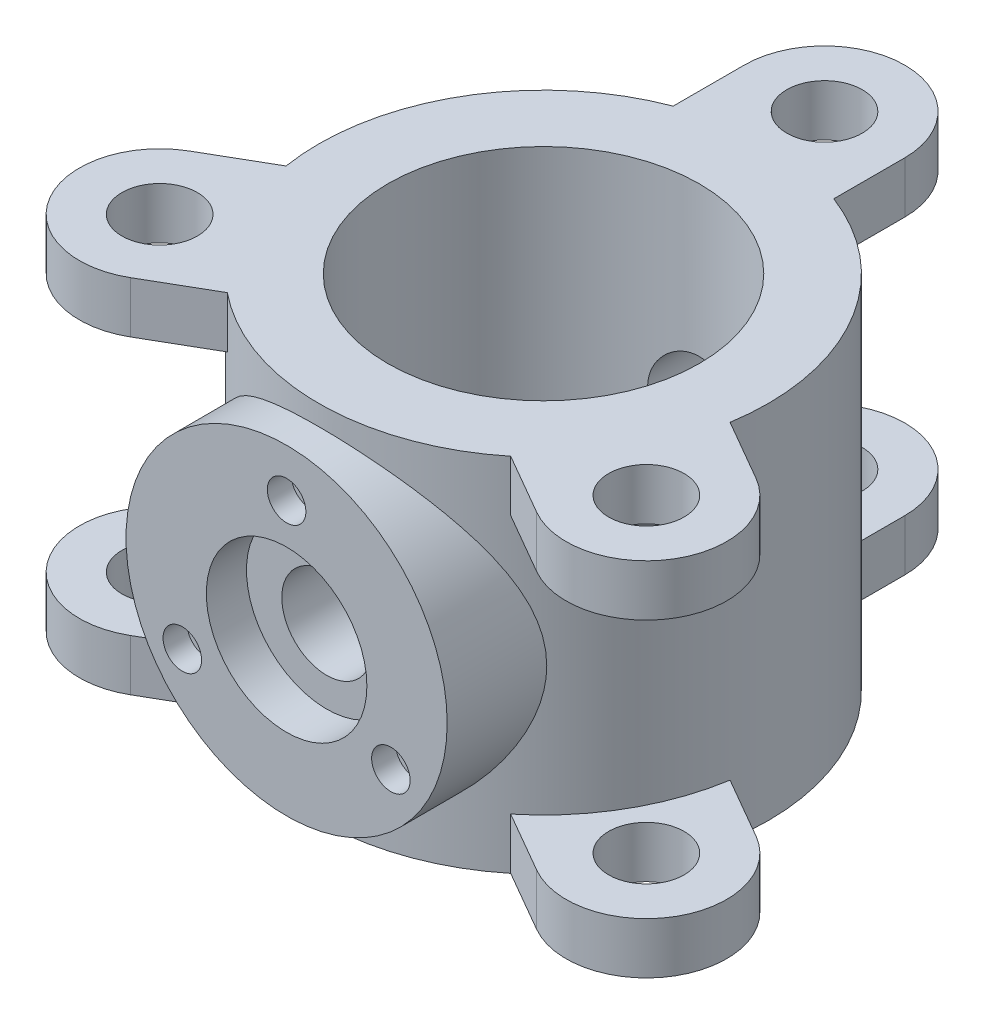
from build123d import *

# Parameters (mm, degrees)
SKETCH1_R                = 140
SKETCH1_R_2              = 97
BOSS_EXTRUDE1_DEPTH      = 225
SKETCH2_R                = 23.5
BOSS_EXTRUDE2_DEPTH      = 32
CIRPATTERN1_COUNT        = 3
MIRROR1_COPY_1_SKETCH_R  = 23.5
MIRROR1_COPY_1_DEPTH     = 32
MIRROR1_COPY_2_SKETCH_R  = 23.5
MIRROR1_COPY_2_DEPTH     = 32
BOSS_EXTRUDE3_REACH      = 491.361
BOSS_EXTRUDE3_END_RADIUS = 140
SKETCH3_R                = 100
SKETCH4_R                = 50
CUT_EXTRUDE1_DEPTH       = 25
SKETCH5_R                = 28
CUT_EXTRUDE2_DEPTH       = 470.945948606
SKETCH6_R                = 12
CUT_EXTRUDE3_DEPTH       = 15
CIRPATTERN2_COUNT        = 3


with BuildPart() as part:
    # Sketch1 → Boss-Extrude1 (new body)
    with BuildSketch(Plane(origin=(0, 0, 0), x_dir=(1, 0, 0), z_dir=(0, 1, 0))):
        with Locations(Location((0, 0, 0), (0, 0, 270))):
            Circle(SKETCH1_R)
        with Locations(Location((0, 0, 0), (0, 0, 270))):
            Circle(SKETCH1_R_2, mode=Mode.SUBTRACT)
    extrude(amount=BOSS_EXTRUDE1_DEPTH)

    # Sketch2 → Boss-Extrude2 (add)
    with BuildSketch(Plane(origin=(0, 225, 0), x_dir=(1, 0, 0), z_dir=(0, 1, 0))):
        with BuildLine():
            Line((-50, 175), (-50, 114.896497963))
            Line((-50, 114.896497963), (50, 114.896497963))
            Line((50, 114.896497963), (50, 175))
            ThreePointArc((50, 175), (0, 225), (-50, 175))
        make_face()
        with Locations(Location((0, 175, 0), (0, 0, 270))):
            Circle(SKETCH2_R, mode=Mode.SUBTRACT)
    boss_extrude2 = extrude(amount=-BOSS_EXTRUDE2_DEPTH)

    # CirPattern1: Boss-Extrude2 ×3 about axis
    cirpattern1_axis = Axis((0, 0, 0), (0, 1, 0))
    for i in range(1, CIRPATTERN1_COUNT):
        add(boss_extrude2.rotate(cirpattern1_axis, i * 360 / CIRPATTERN1_COUNT))

    # Mirror1: Boss-Extrude2 across plane
    add(boss_extrude2.mirror(Plane.ZX.offset(112.5)))

    # Mirror1 copy 1 sketch → Mirror1 copy 1 (add)
    with BuildSketch(Plane(origin=(0, 0, 0), x_dir=(-0.4999999999999998, 0, -0.8660254037844387), z_dir=(0, -1, 0))):
        with BuildLine():
            Line((-50, -175), (-50, -114.896497963))
            Line((-50, -114.896497963), (50, -114.896497963))
            Line((50, -114.896497963), (50, -175))
            ThreePointArc((50, -175), (0, -225), (-50, -175))
        make_face()
        with Locations((0, -175)):
            Circle(MIRROR1_COPY_1_SKETCH_R, mode=Mode.SUBTRACT)
    extrude(amount=-MIRROR1_COPY_1_DEPTH)

    # Mirror1 copy 2 sketch → Mirror1 copy 2 (add)
    with BuildSketch(Plane(origin=(0, 0, 0), x_dir=(-0.5000000000000004, 0, 0.8660254037844384), z_dir=(0, -1, 0))):
        with BuildLine():
            Line((-50, -175), (-50, -114.896497963))
            Line((-50, -114.896497963), (50, -114.896497963))
            Line((50, -114.896497963), (50, -175))
            ThreePointArc((50, -175), (0, -225), (-50, -175))
        make_face()
        with Locations((0, -175)):
            Circle(MIRROR1_COPY_2_SKETCH_R, mode=Mode.SUBTRACT)
    extrude(amount=-MIRROR1_COPY_2_DEPTH)

    # Boss-Extrude3: up to this cylinder (the profile starts outside it)
    boss_extrude3_end = Plane(origin=(0, 112.5, 0), z_dir=(0, -1, 0)) * Cylinder(BOSS_EXTRUDE3_END_RADIUS, 1263.722, mode=Mode.PRIVATE)
    # Sketch3 → Boss-Extrude3 (add, up to the surface)
    with BuildSketch(Plane.XY.offset(160), mode=Mode.PRIVATE) as boss_extrude3_sk1:
        with Locations((0, 112.5)):
            Circle(SKETCH3_R)
    boss_extrude3_tool1 = extrude(boss_extrude3_sk1.sketch, amount=-BOSS_EXTRUDE3_REACH, mode=Mode.PRIVATE) - boss_extrude3_end
    add(boss_extrude3_tool1.solids().sort_by_distance((0, 112.5, 160))[0])

    # Sketch4 → Cut-Extrude1 (cut)
    with BuildSketch(Plane.XY.offset(160)):
        with Locations((0, 107.597966267)):
            Circle(SKETCH4_R)
    extrude(amount=-CUT_EXTRUDE1_DEPTH, mode=Mode.SUBTRACT)

    # Sketch5 → Cut-Extrude2 (cut, through all)
    with BuildSketch(Plane.XY.offset(135)):
        with Locations((0, 103.822189438)):
            Circle(SKETCH5_R)
    extrude(amount=-CUT_EXTRUDE2_DEPTH, mode=Mode.SUBTRACT)

    # Sketch6 → Cut-Extrude3 (cut)
    with BuildSketch(Plane.XY.offset(160)):
        with Locations((0, 182.597966267)):
            Circle(SKETCH6_R)
    cut_extrude3 = extrude(amount=-CUT_EXTRUDE3_DEPTH, mode=Mode.SUBTRACT)

    # CirPattern2: Cut-Extrude3 ×3 about axis
    cirpattern2_axis = Axis((0, 107.597966267, 0), (0, 0, 1))
    for i in range(1, CIRPATTERN2_COUNT):
        add(cut_extrude3.rotate(cirpattern2_axis, i * 360 / CIRPATTERN2_COUNT), mode=Mode.SUBTRACT)


solid = part.part
